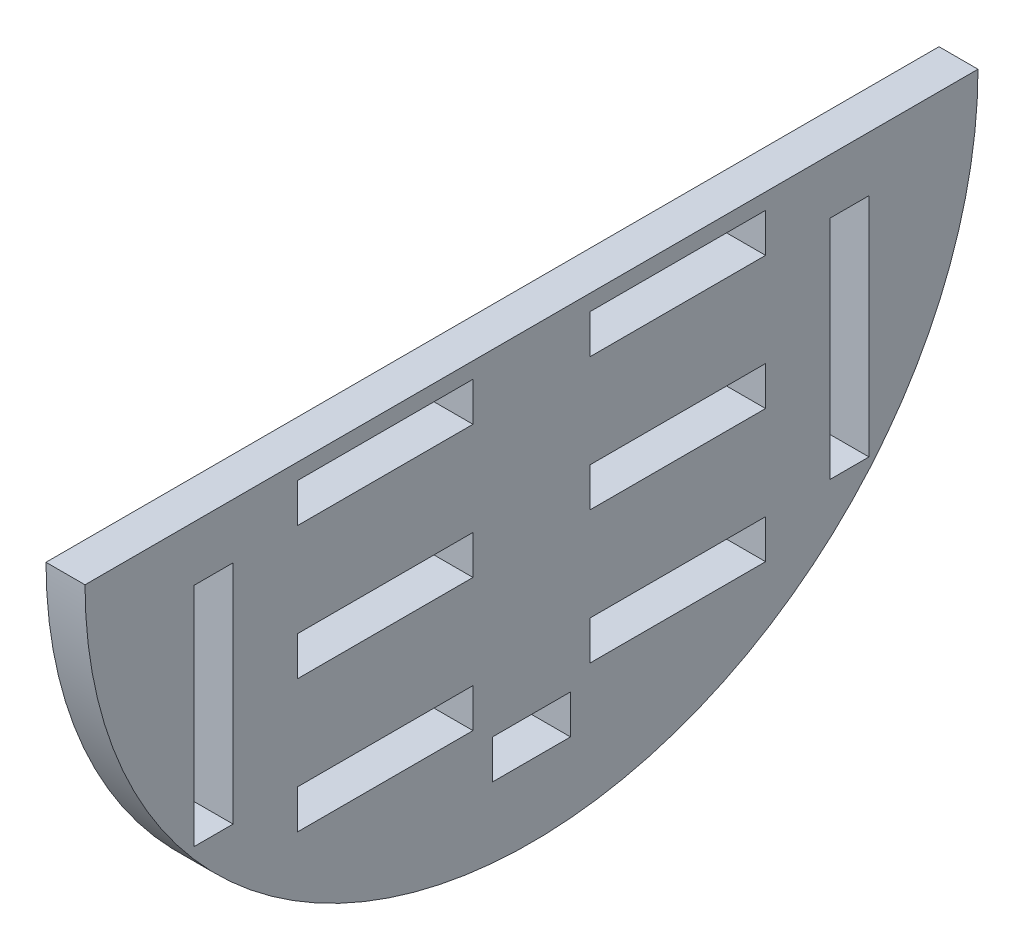
from build123d import *

# Parameters (mm, degrees)
SKETCH1_W           = 22.5
SKETCH1_H           = 5
SKETCH1_W_2         = 10
SKETCH1_W_3         = 5
SKETCH1_H_2         = 29
BOSS_EXTRUDE1_DEPTH = 5


with BuildPart() as part:
    # Sketch1 → Boss-Extrude1 (new body)
    with BuildSketch(Plane(origin=(0, 0, 0), x_dir=(0, 0, -1), z_dir=(1, 0, 0))):
        with BuildLine():
            Line((57.224821465, 0), (-57.224821465, 0))
            ThreePointArc((-57.224821465, 0), (0, -57.224821465), (57.224821465, 0))
        make_face()
        with Locations((-18.75, -38.548791642)):
            Rectangle(SKETCH1_W, SKETCH1_H, mode=Mode.SUBTRACT)
        with Locations((0, -45.5)):
            Rectangle(SKETCH1_W_2, SKETCH1_H, mode=Mode.SUBTRACT)
        with Locations((18.75, -38.548791642)):
            Rectangle(SKETCH1_W, SKETCH1_H, mode=Mode.SUBTRACT)
        with Locations((-40.75, -21.548791642)):
            Rectangle(SKETCH1_W_3, SKETCH1_H_2, mode=Mode.SUBTRACT)
        with Locations((-18.75, -21.548791642)):
            Rectangle(SKETCH1_W, SKETCH1_H, mode=Mode.SUBTRACT)
        with Locations((-18.75, -4.548791642)):
            Rectangle(SKETCH1_W, SKETCH1_H, mode=Mode.SUBTRACT)
        with Locations((40.75, -21.548791642)):
            Rectangle(SKETCH1_W_3, SKETCH1_H_2, mode=Mode.SUBTRACT)
        with Locations((18.75, -21.548791642)):
            Rectangle(SKETCH1_W, SKETCH1_H, mode=Mode.SUBTRACT)
        with Locations((18.75, -4.548791642)):
            Rectangle(SKETCH1_W, SKETCH1_H, mode=Mode.SUBTRACT)
    extrude(amount=BOSS_EXTRUDE1_DEPTH)


solid = part.part
